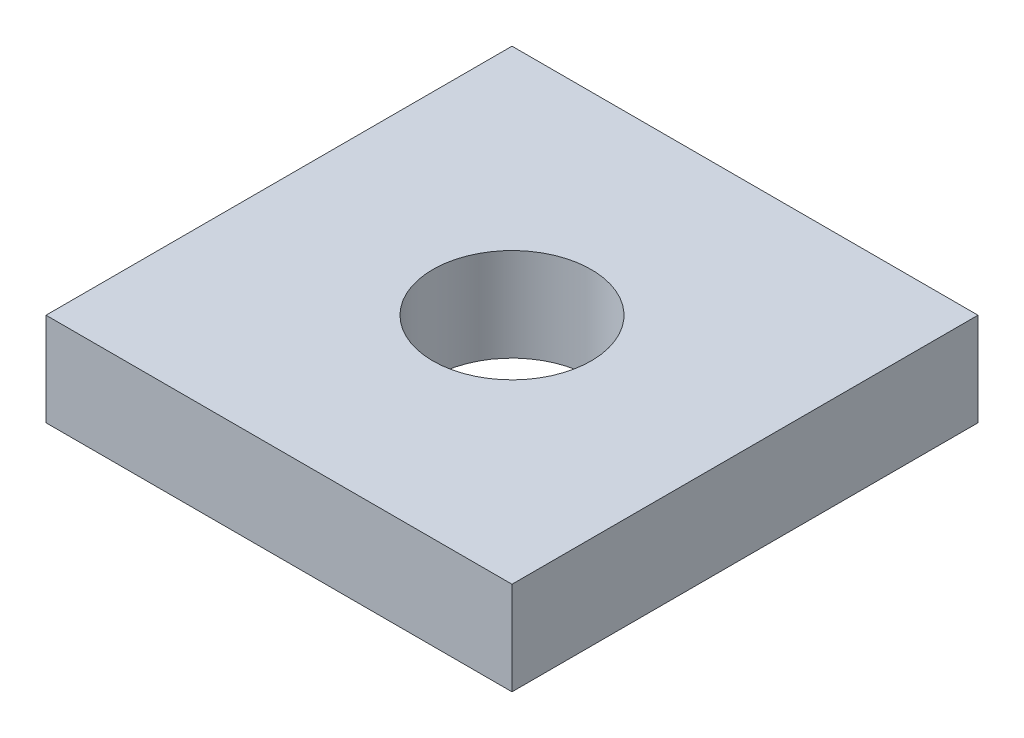
from build123d import *

# Parameters (mm, degrees)
SKETCH1_W              = 20
SKETCH1_H              = 4
BOSS_EXTRUDE1_DEPTH    = 10
M8X1_25_TAPPED_HOLE1_D = 6.8


with BuildPart() as part:
    # Sketch1 → Boss-Extrude1 (new, symmetric)
    with BuildSketch(Plane.XY):
        Rectangle(SKETCH1_W, SKETCH1_H)
    extrude(amount=BOSS_EXTRUDE1_DEPTH, both=True)

    # M8x1.25 Tapped Hole1 (through all)
    with Locations(Plane(origin=(0, 2, 0), x_dir=(1, 0, 0), z_dir=(0, 1, 0))):
        with Locations((0, 0)):
            Hole(M8X1_25_TAPPED_HOLE1_D / 2)


solid = part.part
